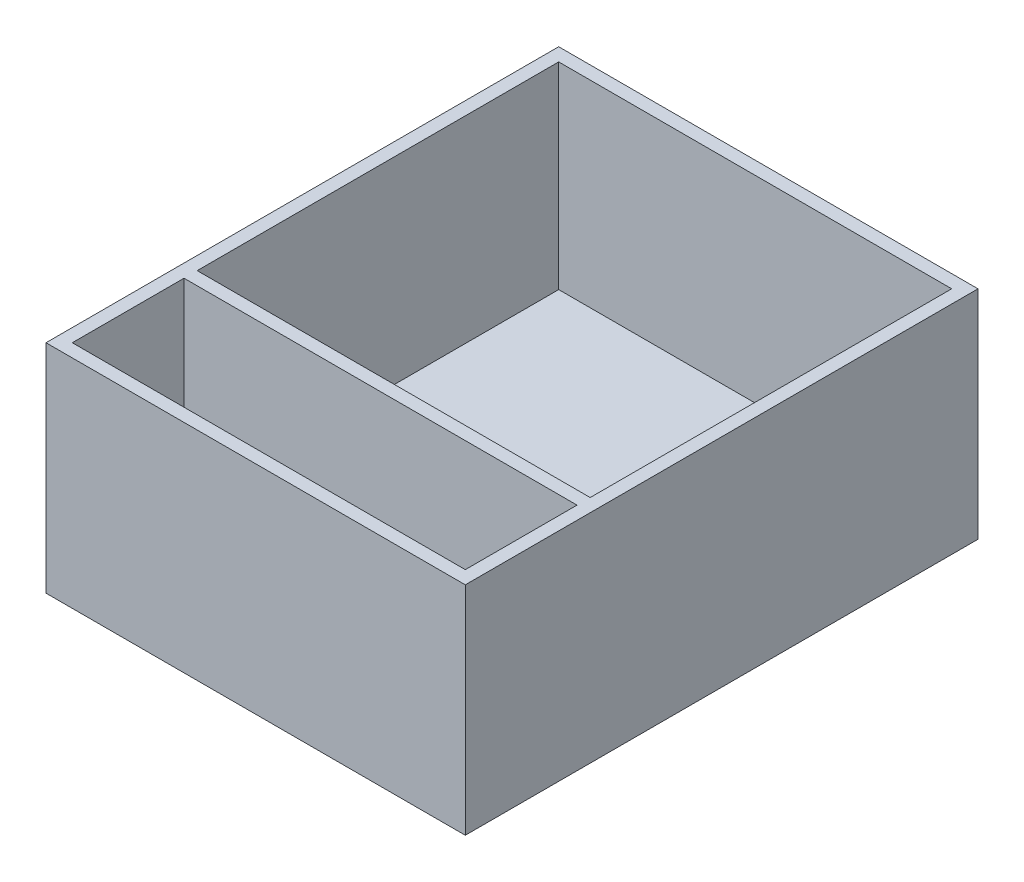
from build123d import *

# Parameters (mm, degrees)
SKETCH2_W           = 63.79
SKETCH2_H           = 78
SKETCH2_W_2         = 59.79
SKETCH2_H_2         = 55
SKETCH2_H_3         = 17
BOSS_EXTRUDE1_DEPTH = 30
SKETCH4_W           = 63.79
SKETCH4_H           = 78
BOSS_EXTRUDE2_DEPTH = 3


with BuildPart() as part:
    # Sketch2 → Boss-Extrude1 (new body)
    with BuildSketch(Plane(origin=(0, 0, 0), x_dir=(1, 0, 0), z_dir=(0, 1, 0))):
        with Locations((2.679262675, -32.730163819)):
            Rectangle(SKETCH2_W, SKETCH2_H)
        with Locations((2.679262675, -23.230163819)):
            Rectangle(SKETCH2_W_2, SKETCH2_H_2, mode=Mode.SUBTRACT)
        with Locations((2.679262675, -61.230163819)):
            Rectangle(SKETCH2_W_2, SKETCH2_H_3, mode=Mode.SUBTRACT)
    extrude(amount=BOSS_EXTRUDE1_DEPTH)

    # Sketch4 → Boss-Extrude2 (add)
    with BuildSketch(Plane.XZ):
        with Locations((2.679262675, 32.730163819)):
            Rectangle(SKETCH4_W, SKETCH4_H)
    extrude(amount=BOSS_EXTRUDE2_DEPTH)


solid = part.part
